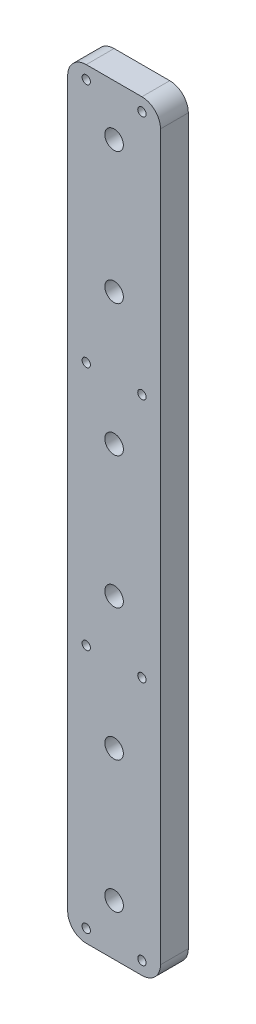
from build123d import *

# Parameters (mm, degrees)
ESQUISSE1_W                  = 50
ESQUISSE1_H                  = 410
BOSS_EXTRU_1_DEPTH           = 15
ENL_V_MAT_EXTRU_1_DEPTH      = 414.309811159
ENL_V_MAT_EXTRU_1_DEPTH_BACK = 414.309811159
ESQUISSE2_R                  = 5
ESQUISSE2_R_2                = 2.25
CONG_1_R                     = 10


with BuildPart() as part:
    # Esquisse1 → Boss.-Extru.1 (new body)
    with BuildSketch(Plane.XY):
        with Locations((25, 205)):
            Rectangle(ESQUISSE1_W, ESQUISSE1_H)
    extrude(amount=BOSS_EXTRU_1_DEPTH)

    # Esquisse2 → Enlèv. mat.-Extru.1 (cut, two sides: drawn at the far end of the back side and taken through both)
    with BuildSketch(Plane.XY.offset(15).offset(-ENL_V_MAT_EXTRU_1_DEPTH_BACK)):
        with Locations((25, 240.5)):
            Circle(ESQUISSE2_R)
        with Locations((25, 311.5)):
            Circle(ESQUISSE2_R)
        with Locations((25, 382.5)):
            Circle(ESQUISSE2_R)
        with Locations(Location((25, 27.5, 0), (0, 0, 180))):
            Circle(ESQUISSE2_R)
        with Locations(Location((25, 98.5, 0), (0, 0, 180))):
            Circle(ESQUISSE2_R)
        with Locations(Location((25, 169.5, 0), (0, 0, 180))):
            Circle(ESQUISSE2_R)
        with Locations((40, 271)):
            Circle(ESQUISSE2_R_2)
        with Locations((40, 403)):
            Circle(ESQUISSE2_R_2)
        with Locations(Location((40, 7, 0), (0, 0, 180))):
            Circle(ESQUISSE2_R_2)
        with Locations(Location((40, 139, 0), (0, 0, 180))):
            Circle(ESQUISSE2_R_2)
        with Locations((10, 139)):
            Circle(ESQUISSE2_R_2)
        with Locations((10, 7)):
            Circle(ESQUISSE2_R_2)
        with Locations(Location((10, 403, 0), (0, 0, 180))):
            Circle(ESQUISSE2_R_2)
        with Locations(Location((10, 271, 0), (0, 0, 180))):
            Circle(ESQUISSE2_R_2)
    extrude(amount=ENL_V_MAT_EXTRU_1_DEPTH + ENL_V_MAT_EXTRU_1_DEPTH_BACK, mode=Mode.SUBTRACT)

    # Congé1
    cong_1_edges = [part.edges().sort_by_distance(p)[0] for p in [
        (0, 410, 7.5),
        (50, 410, 7.5),
        (50, 0, 7.5),
        (0, 0, 7.5),
    ]]
    fillet(cong_1_edges, radius=CONG_1_R)


solid = part.part
